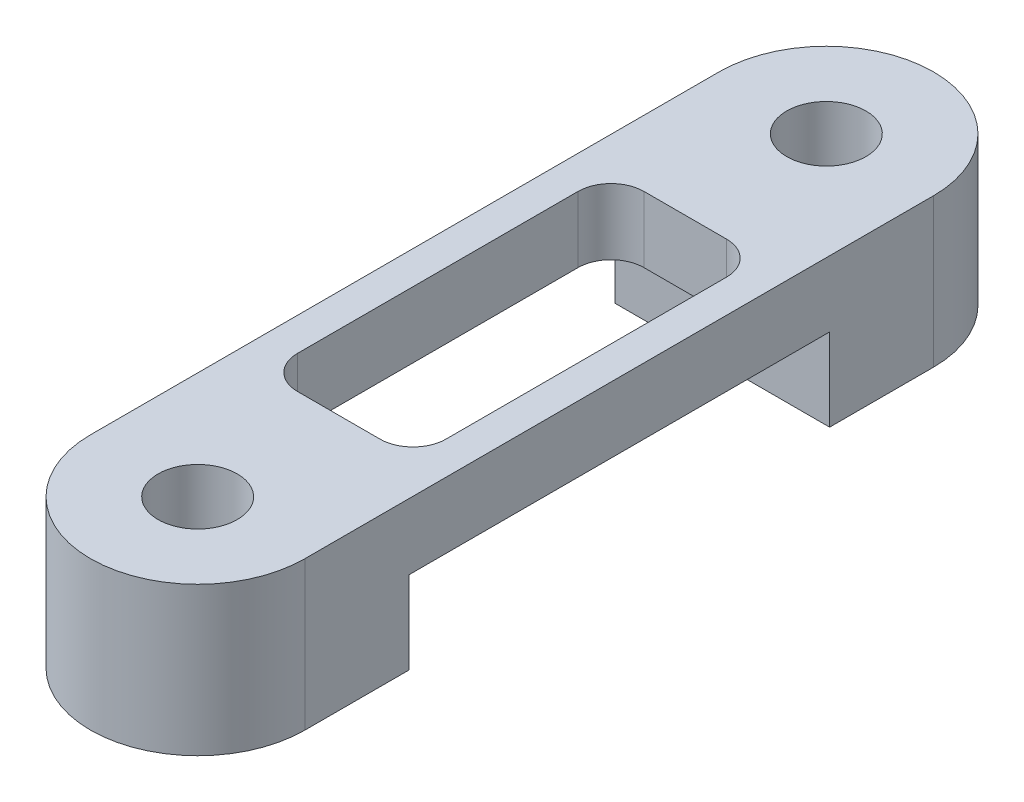
from build123d import *

# Parameters (mm, degrees)
SKETCH1_W            = 4.5
SKETCH1_H            = 10.5
BOSS_EXTRUDE1_DEPTH  = 2
BOSS_EXTRUDE2_START  = -2
BOSS_EXTRUDE2_DEPTH  = 2.5
M2_CLEARANCE_HOLE1_D = 2.4
FILLET1_R            = 1


with BuildPart() as part:
    # Sketch1 → Boss-Extrude1 (new body)
    with BuildSketch(Plane(origin=(0, 0, 0), x_dir=(1, 0, 0), z_dir=(0, 1, 0))):
        with BuildLine():
            Line((3.25, 9.525), (3.25, -9.525))
            ThreePointArc((3.25, -9.525), (0, -12.775), (-3.25, -9.525))
            Line((-3.25, -9.525), (-3.25, 9.525))
            ThreePointArc((-3.25, 9.525), (0, 12.775), (3.25, 9.525))
        make_face()
        Rectangle(SKETCH1_W, SKETCH1_H, mode=Mode.SUBTRACT)
    extrude(amount=-BOSS_EXTRUDE1_DEPTH)

    # Sketch1<3> → Boss-Extrude2 (add)
    with BuildSketch(Plane(origin=(0, 0, 0), x_dir=(1, 0, 0), z_dir=(0, 1, 0)).offset(BOSS_EXTRUDE2_START)):
        with BuildLine():
            Line((-3.25, 9.525), (-3.25, 6.375))
            Line((-3.25, 6.375), (3.25, 6.375))
            Line((3.25, 6.375), (3.25, 9.525))
            ThreePointArc((3.25, 9.525), (0, 12.775), (-3.25, 9.525))
        make_face()
        with BuildLine():
            Line((3.25, -6.375), (-3.25, -6.375))
            Line((-3.25, -6.375), (-3.25, -9.525))
            ThreePointArc((-3.25, -9.525), (0, -12.775), (3.25, -9.525))
            Line((3.25, -9.525), (3.25, -6.375))
        make_face()
    extrude(amount=-BOSS_EXTRUDE2_DEPTH)

    # M2 Clearance Hole1 (through all)
    with Locations(Plane(origin=(0, -4.5, 0), x_dir=(-1, 0, 0), z_dir=(0, -1, 0))):
        with Locations((0, 9.525), (0, -9.525)):
            Hole(M2_CLEARANCE_HOLE1_D / 2)

    # Fillet1
    fillet1_edges = [part.edges().sort_by_distance(p)[0] for p in [
        (-2.25, -1, 5.25),
        (2.25, -1, 5.25),
        (2.25, -1, -5.25),
        (-2.25, -1, -5.25),
    ]]
    fillet(fillet1_edges, radius=FILLET1_R)


solid = part.part
